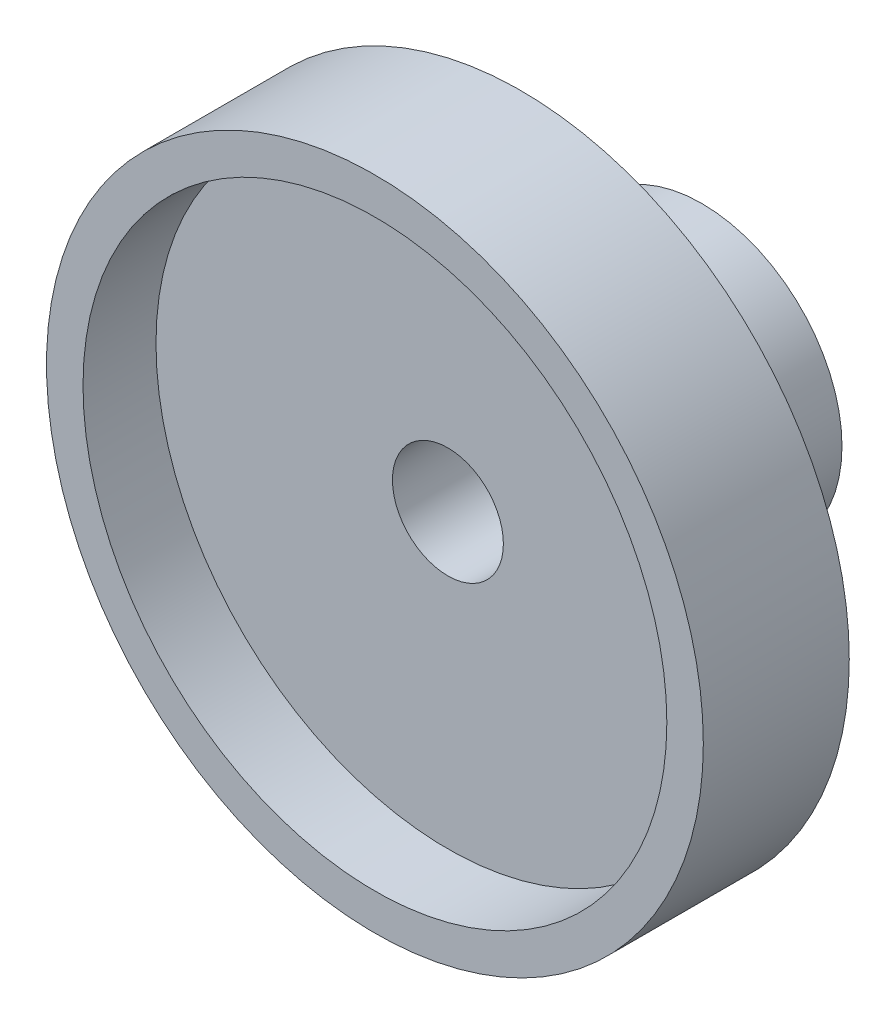
from build123d import *

# Parameters (mm, degrees)
SKETCH1_R           = 14.2875
BOSS_EXTRUDE1_DEPTH = 6.35
SKETCH2_R           = 12.7
CUT_EXTRUDE1_DEPTH  = 3.175
SKETCH3_R           = 6.096
BOSS_EXTRUDE2_DEPTH = 7.874
SKETCH4_R           = 2.413
CUT_EXTRUDE2_DEPTH  = 11.049


with BuildPart() as part:
    # Sketch1 → Boss-Extrude1 (new body)
    with BuildSketch(Plane.XY):
        Circle(SKETCH1_R)
    extrude(amount=BOSS_EXTRUDE1_DEPTH)

    # Sketch2 → Cut-Extrude1 (cut)
    with BuildSketch(Plane.XY.offset(6.35)):
        Circle(SKETCH2_R)
    extrude(amount=-CUT_EXTRUDE1_DEPTH, mode=Mode.SUBTRACT)

    # Sketch3 → Boss-Extrude2 (add)
    with BuildSketch(Plane(origin=(0, 0, 0), x_dir=(-1, 0, 0), z_dir=(0, 0, -1))):
        Circle(SKETCH3_R)
    extrude(amount=BOSS_EXTRUDE2_DEPTH)

    # Sketch4 → Cut-Extrude2 (cut)
    with BuildSketch(Plane(origin=(0, 0, -7.874), x_dir=(-1, 0, 0), z_dir=(0, 0, -1))):
        Circle(SKETCH4_R)
    extrude(amount=-CUT_EXTRUDE2_DEPTH, mode=Mode.SUBTRACT)


solid = part.part
